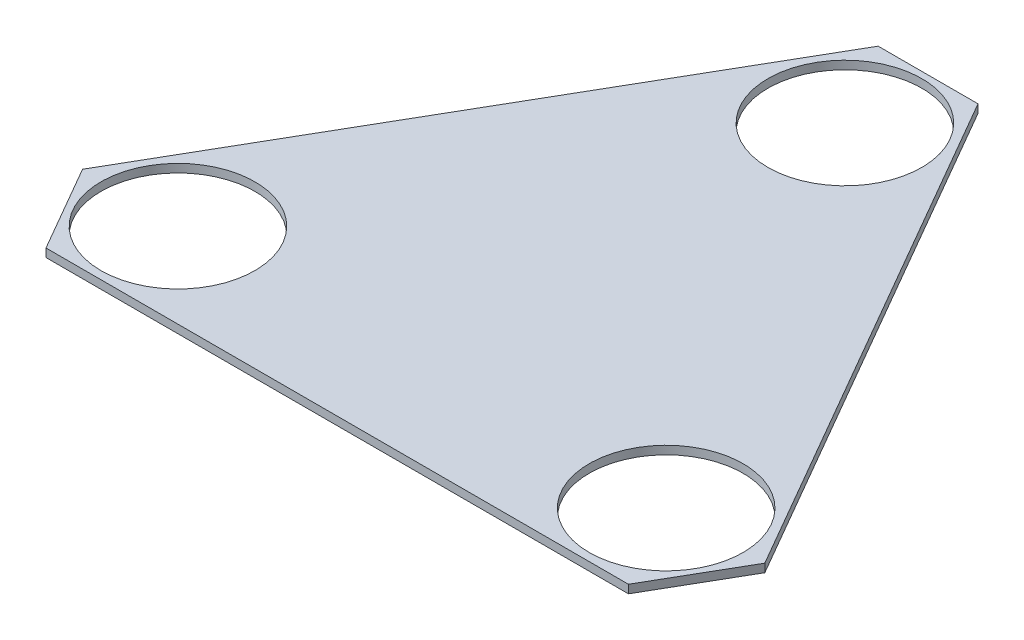
from build123d import *

# Parameters (mm, degrees)
EXTRUDE_1_DEPTH     = 10
SKETCH_2_R          = 92.5
CUT_EXTRUDE_1_DEPTH = 10


with BuildPart() as part:
    # 草图1 → 凸台-拉伸1 (new body)
    with BuildSketch(Plane(origin=(0, 0, 0), x_dir=(1, 0, 0), z_dir=(0, 1, 0))):
        Polygon((0, 0), (700, 0), (760, 103.923048454), (410, 710.140831103), (290, 710.140831103), (-60, 103.923048454), align=None)
    extrude(amount=EXTRUDE_1_DEPTH)

    # 草图2 → 切除-拉伸1 (cut)
    with BuildSketch(Plane(origin=(0, 10, 0), x_dir=(1, 0, 0), z_dir=(0, 1, 0))):
        with Locations(Location((56.602540378, 101.961524227, 0), (0, 0, 270))):
            Circle(SKETCH_2_R)
        with Locations(Location((643.397459622, 101.961524227, 0), (0, 0, 270))):
            Circle(SKETCH_2_R)
        with Locations(Location((350, 610.140831103, 0), (0, 0, 270))):
            Circle(SKETCH_2_R)
    extrude(amount=-CUT_EXTRUDE_1_DEPTH, mode=Mode.SUBTRACT)


solid = part.part
